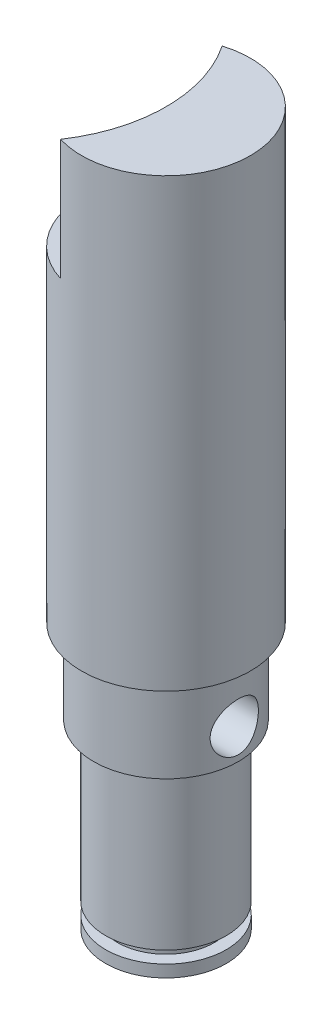
from build123d import *

# Parameters (mm, degrees)
SKETCH1_R               = 2.5
BOSS_EXTRUDE1_DEPTH     = 0.5
SKETCH2_R               = 2
BOSS_EXTRUDE2_DEPTH     = 0.5
SKETCH3_R               = 2.5
BOSS_EXTRUDE3_DEPTH     = 6.5
SKETCH4_R               = 3
BOSS_EXTRUDE4_DEPTH     = 3.5
SKETCH5_R               = 3.5
BOSS_EXTRUDE5_DEPTH     = 18.5
CUT_EXTRUDE2_START      = 24.5
CUT_EXTRUDE2_DEPTH      = 5
CUT_EXTRUDE3_DEPTH      = 30.912372022
CUT_EXTRUDE3_DEPTH_BACK = 30.912372022
SKETCH10_R              = 1


with BuildPart() as part:
    # Sketch1 → Boss-Extrude1 (new body)
    with BuildSketch(Plane(origin=(0, 0, 0), x_dir=(1, 0, 0), z_dir=(0, 1, 0))):
        with Locations(Location((0, 0, 0), (0, 0, 270))):
            Circle(SKETCH1_R)
    extrude(amount=BOSS_EXTRUDE1_DEPTH)

    # Sketch2 → Boss-Extrude2 (add)
    with BuildSketch(Plane(origin=(0, 0.5, 0), x_dir=(1, 0, 0), z_dir=(0, 1, 0))):
        with Locations(Location((0, 0, 0), (0, 0, 270))):
            Circle(SKETCH2_R)
    extrude(amount=BOSS_EXTRUDE2_DEPTH)

    # Sketch3 → Boss-Extrude3 (add)
    with BuildSketch(Plane(origin=(0, 1, 0), x_dir=(1, 0, 0), z_dir=(0, 1, 0))):
        with Locations(Location((0, 0, 0), (0, 0, 270))):
            Circle(SKETCH3_R)
    extrude(amount=BOSS_EXTRUDE3_DEPTH)

    # Sketch4 → Boss-Extrude4 (add)
    with BuildSketch(Plane(origin=(0, 7.5, 0), x_dir=(1, 0, 0), z_dir=(0, 1, 0))):
        with Locations(Location((0, 0, 0), (0, 0, 270))):
            Circle(SKETCH4_R)
    extrude(amount=BOSS_EXTRUDE4_DEPTH)

    # Sketch5 → Boss-Extrude5 (add)
    with BuildSketch(Plane(origin=(0, 11, 0), x_dir=(1, 0, 0), z_dir=(0, 1, 0))):
        with Locations(Location((0, 0, 0), (0, 0, 270))):
            Circle(SKETCH5_R)
    extrude(amount=BOSS_EXTRUDE5_DEPTH)

    # Sketch8 → Cut-Extrude2 (cut)
    with BuildSketch(Plane(origin=(0, 0, 0), x_dir=(1, 0, 0), z_dir=(0, 1, 0)).offset(CUT_EXTRUDE2_START)):
        with BuildLine():
            ThreePointArc((-1.020833333, 3.347820083), (0, 0), (-1.020833333, -3.347820083))
            ThreePointArc((-1.020833333, -3.347820083), (-3.5, 0), (-1.020833333, 3.347820083))
        make_face()
    extrude(amount=CUT_EXTRUDE2_DEPTH, mode=Mode.SUBTRACT)

    # Sketch10 → Cut-Extrude3 (cut, two sides: drawn at the far end of the back side and taken through both)
    with BuildSketch(Plane(origin=(0, 0, 0), x_dir=(0, 0, -1), z_dir=(1, 0, 0)).offset(-CUT_EXTRUDE3_DEPTH_BACK)):
        with Locations((0, 8.75)):
            Circle(SKETCH10_R)
    extrude(amount=CUT_EXTRUDE3_DEPTH + CUT_EXTRUDE3_DEPTH_BACK, mode=Mode.SUBTRACT)


solid = part.part
